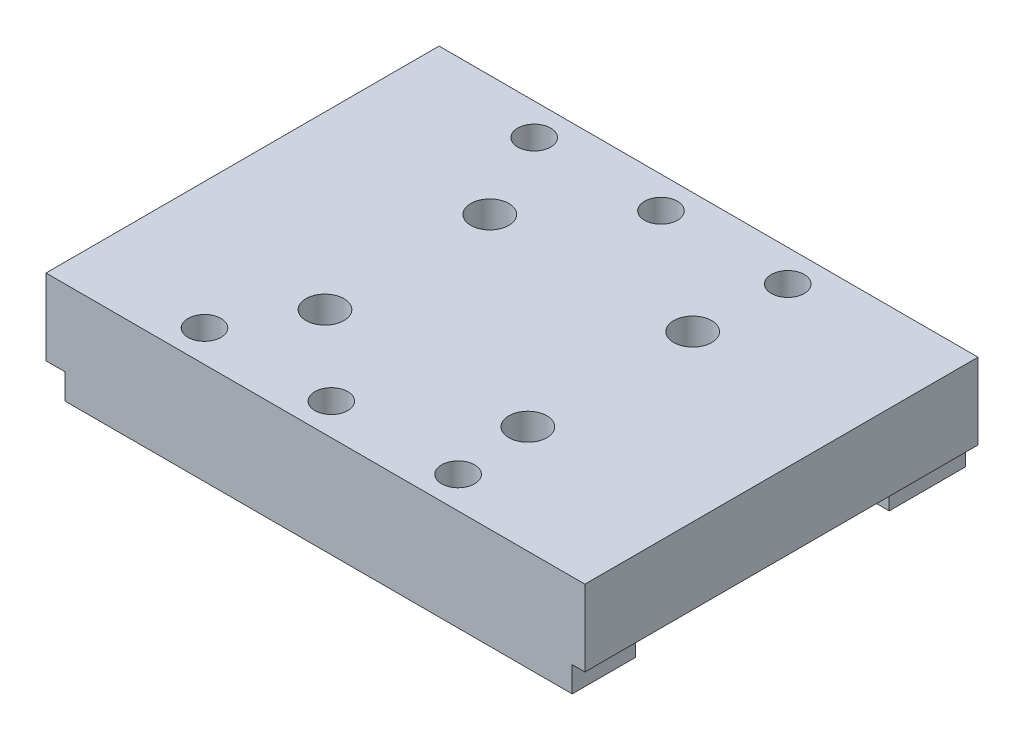
from build123d import *

# Parameters (mm, degrees)
SKETCH_1_W          = 40
SKETCH_1_H          = 20
EXTRUDE_1_DEPTH     = 3
SKETCH_2_R          = 1.5
CUT_EXTRUDE_1_DEPTH = 3
SKETCH_3_W          = 40
SKETCH_3_H          = 8
EXTRUDE_2_DEPTH     = 5
SKETCH_4_W          = 40
SKETCH_4_H          = 8
EXTRUDE_3_DEPTH     = 6
SKETCH_6_R          = 1.3
CUT_EXTRUDE_2_DEPTH = 8
SKETCH_11_W         = 1.5
SKETCH_11_H         = 6
EXTRUDE_5_DEPTH     = 31
SKETCH_12_W         = 31
SKETCH_12_H         = 6
EXTRUDE_6_DEPTH     = 1


with BuildPart() as part:
    # 草圖1 → 填料-伸長1 (new body)
    with BuildSketch(Plane(origin=(0, 0, 0), x_dir=(1, 0, 0), z_dir=(0, 1, 0))):
        with Locations((20, 10)):
            Rectangle(SKETCH_1_W, SKETCH_1_H)
    extrude(amount=EXTRUDE_1_DEPTH)

    # 草圖2 → 除料-伸長1 (cut)
    with BuildSketch(Plane(origin=(0, 3, 0), x_dir=(1, 0, 0), z_dir=(0, 1, 0))):
        with Locations(Location((28, 16.5, 0), (0, 0, 270))):
            Circle(SKETCH_2_R)
        with Locations(Location((12, 16.5, 0), (0, 0, 270))):
            Circle(SKETCH_2_R)
        with Locations(Location((12, 3.5, 0), (0, 0, 270))):
            Circle(SKETCH_2_R)
        with Locations(Location((28, 3.5, 0), (0, 0, 270))):
            Circle(SKETCH_2_R)
    extrude(amount=-CUT_EXTRUDE_1_DEPTH, mode=Mode.SUBTRACT)

    # 草圖3 → 填料-伸長2 (add)
    with BuildSketch(Plane.XY):
        with Locations((20, -1)):
            Rectangle(SKETCH_3_W, SKETCH_3_H)
    extrude(amount=EXTRUDE_2_DEPTH)

    # 草圖4 → 填料-伸長3 (add)
    with BuildSketch(Plane(origin=(0, 0, -20), x_dir=(-1, 0, 0), z_dir=(0, 0, -1))):
        with Locations((-20, -1)):
            Rectangle(SKETCH_4_W, SKETCH_4_H)
    extrude(amount=EXTRUDE_3_DEPTH)

    # 草圖6 → 除料-伸長2 (cut)
    with BuildSketch(Plane(origin=(0, 3, 0), x_dir=(1, 0, 0), z_dir=(0, 1, 0))):
        with Locations(Location((8.5, 23.5, 0), (0, 0, 270))):
            Circle(SKETCH_6_R)
        with Locations(Location((18.5, 23.5, 0), (0, 0, 270))):
            Circle(SKETCH_6_R)
        with Locations(Location((28.5, 23.5, 0), (0, 0, 270))):
            Circle(SKETCH_6_R)
        with Locations(Location((8.5, -2.5, 0), (0, 0, 270))):
            Circle(SKETCH_6_R)
        with Locations(Location((18.5, -2.5, 0), (0, 0, 270))):
            Circle(SKETCH_6_R)
        with Locations(Location((28.5, -2.5, 0), (0, 0, 270))):
            Circle(SKETCH_6_R)
    extrude(amount=-CUT_EXTRUDE_2_DEPTH, mode=Mode.SUBTRACT)

    # 草圖11 → 填料-伸長5 (add)
    with BuildSketch(Plane.XY.offset(5)):
        with Locations((-0.75, 0)):
            Rectangle(SKETCH_11_W, SKETCH_11_H)
    extrude(amount=-EXTRUDE_5_DEPTH)

    # 草圖12 → 填料-伸長6 (add)
    with BuildSketch(Plane(origin=(40, 0, 0), x_dir=(0, 0, -1), z_dir=(1, 0, 0))):
        with Locations((10.5, 0)):
            Rectangle(SKETCH_12_W, SKETCH_12_H)
    extrude(amount=EXTRUDE_6_DEPTH)


solid = part.part
